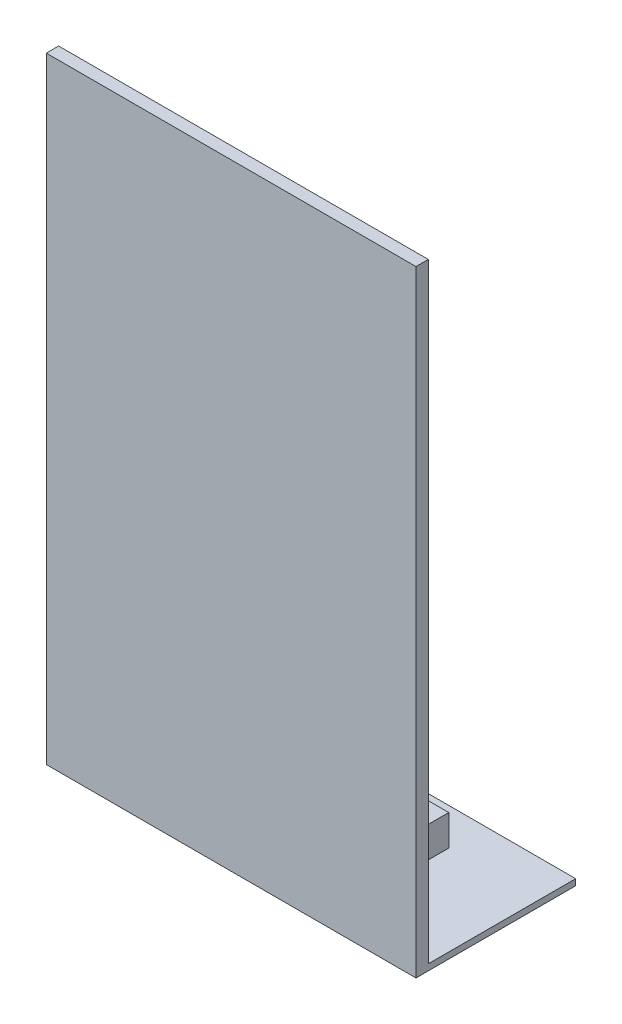
from build123d import *

# Parameters (mm, degrees)
SK_DOCKBASE_W         = 300
SK_DOCKBASE_H         = 129.6
EX_DOCKBASE_DEPTH     = 5
SK_DOCKWALL_W         = 300
SK_DOCKWALL_H         = 10
EX_DOCKWALL_DEPTH     = 500
SK_APRILTAG_W         = 80
SK_APRILTAG_H         = 80
EX_APRILTAG_DEPTH     = 1
SK_DOCKCONTACTS_W     = 26
SK_DOCKCONTACTS_H     = 20
EX_DOCKCONTACTS_DEPTH = 25


with BuildPart() as part:
    # SK_DockBase → EX_DockBase (new body)
    with BuildSketch(Plane(origin=(0, 0, 0), x_dir=(1, 0, 0), z_dir=(0, 1, 0))):
        with Locations((0, -240.8)):
            Rectangle(SK_DOCKBASE_W, SK_DOCKBASE_H)
    extrude(amount=EX_DOCKBASE_DEPTH)

    # SK_DockWall → EX_DockWall (add)
    with BuildSketch(Plane(origin=(0, 0, 0), x_dir=(1, 0, 0), z_dir=(0, 1, 0))):
        with Locations((0, -300.6)):
            Rectangle(SK_DOCKWALL_W, SK_DOCKWALL_H)
    extrude(amount=EX_DOCKWALL_DEPTH)

    # SK_AprilTag → EX_AprilTag (add)
    with BuildSketch(Plane.XY.offset(295.6)):
        with Locations((0, 400)):
            Rectangle(SK_APRILTAG_W, SK_APRILTAG_H)
    extrude(amount=-EX_APRILTAG_DEPTH)

    # SK_DockContacts → EX_DockContacts (add)
    with BuildSketch(Plane(origin=(0, 5, 0), x_dir=(1, 0, 0), z_dir=(0, 1, 0))):
        with Locations((64, -216)):
            Rectangle(SK_DOCKCONTACTS_W, SK_DOCKCONTACTS_H)
        with Locations((-64, -216)):
            Rectangle(SK_DOCKCONTACTS_W, SK_DOCKCONTACTS_H)
    extrude(amount=EX_DOCKCONTACTS_DEPTH)


solid = part.part
